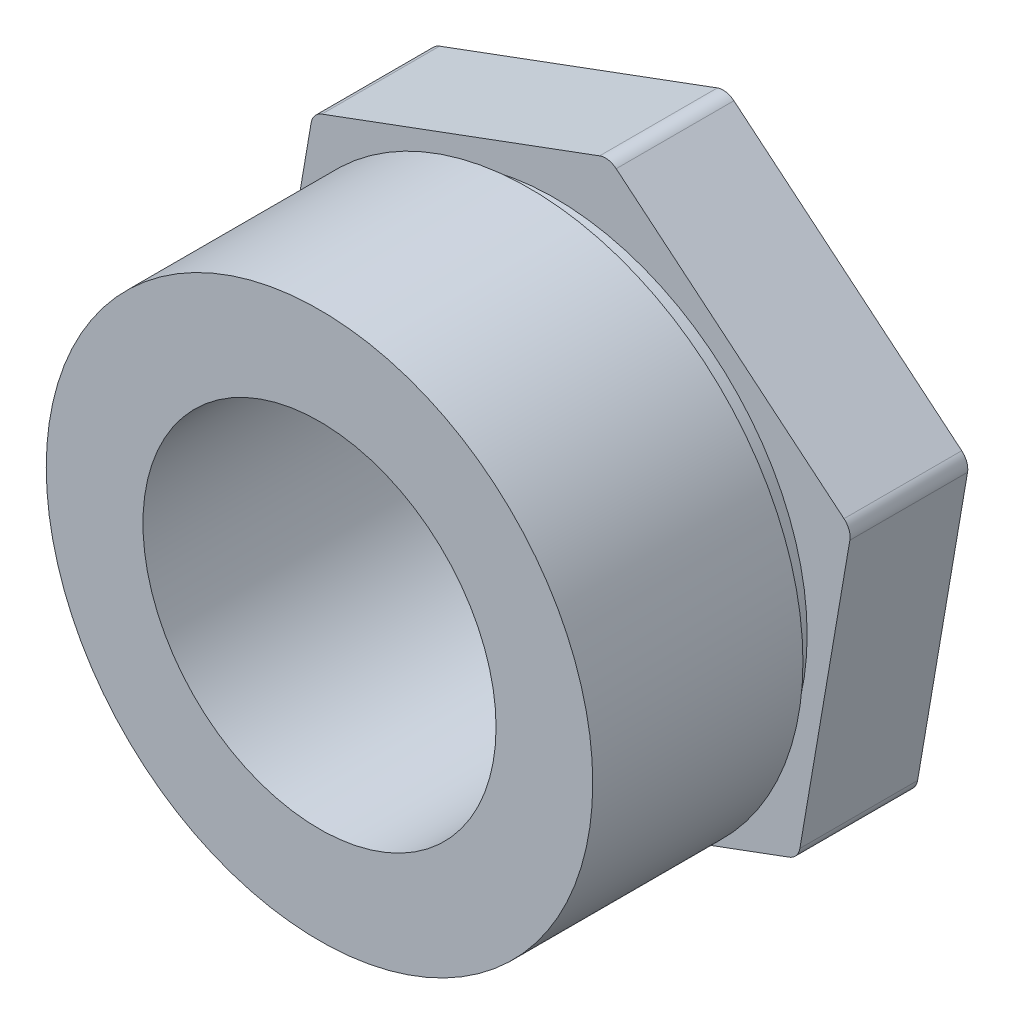
from build123d import *

# Parameters (mm, degrees)
SKETCH1_R           = 32.5
BOSS_EXTRUDE1_DEPTH = 42
CUT_EXTRUDE1_START  = -28
SKETCH2_R           = 32.5
SKETCH2_R_2         = 30
CUT_EXTRUDE1_DEPTH  = 3
BOSS_EXTRUDE2_DEPTH = 14
FILLET1_R           = 2
SKETCH4_R           = 21
CUT_EXTRUDE2_DEPTH  = 67.142933871


with BuildPart() as part:
    # Sketch1 → Boss-Extrude1 (new body)
    with BuildSketch(Plane.XY):
        with Locations(Location((0, 0, 0), (0, 0, 180))):
            Circle(SKETCH1_R)
    extrude(amount=BOSS_EXTRUDE1_DEPTH)

    # Sketch2 → Cut-Extrude1 (cut)
    with BuildSketch(Plane.XY.offset(42).offset(CUT_EXTRUDE1_START)):
        with Locations(Location((0, 0, 0), (0, 0, 180))):
            Circle(SKETCH2_R)
        Circle(SKETCH2_R_2, mode=Mode.SUBTRACT)
    extrude(amount=CUT_EXTRUDE1_DEPTH, mode=Mode.SUBTRACT)

    # Sketch3 → Boss-Extrude2 (add)
    with BuildSketch(Plane(origin=(0, 0, 0), x_dir=(-1, 0, 0), z_dir=(0, 0, -1))):
        Polygon((-35.269916777, 13.430130963), (-28.941400728, -23.560181525), (6.257407604, -36.574682103), (35.127699889, -12.598870193), (28.799183841, 24.391442295), (-6.399624492, 37.405942873), align=None)
    extrude(amount=-BOSS_EXTRUDE2_DEPTH)

    # Fillet1
    fillet1_edges = [part.edges().sort_by_distance(p)[0] for p in [
        (-28.799183841, 24.391442295, 7),
        (-35.127699889, -12.598870193, 7),
        (-6.257407604, -36.574682103, 7),
        (28.941400728, -23.560181525, 7),
        (35.269916777, 13.430130963, 7),
        (6.399624492, 37.405942873, 7),
    ]]
    fillet(fillet1_edges, radius=FILLET1_R)

    # Sketch4 → Cut-Extrude2 (cut, through all)
    with BuildSketch(Plane.XY.offset(42)):
        Circle(SKETCH4_R)
    extrude(amount=-CUT_EXTRUDE2_DEPTH, mode=Mode.SUBTRACT)


solid = part.part
